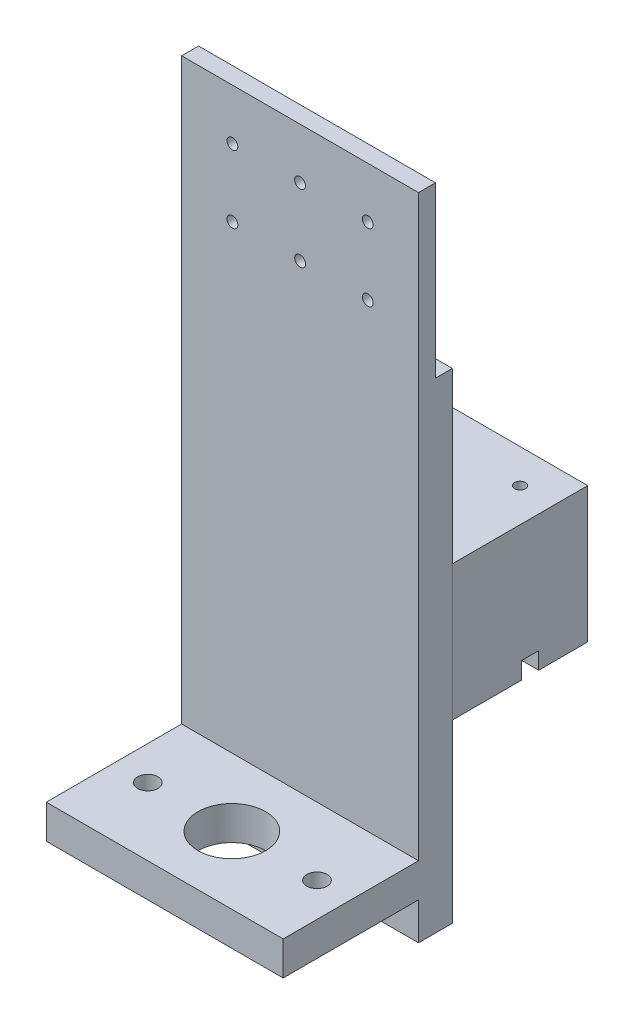
from build123d import *

# Parameters (mm, degrees)
SKETCH_1_W                     = 70
SKETCH_1_H                     = 40
EXTRUDE_1_DEPTH                = 40
SKETCH_2_R                     = 1.6
CUT_EXTRUDE_1_DEPTH            = 60.579081363
EXTRUDE_2_DEPTH                = 52
EXTRUDE_2_DEPTH_BACK           = 236
SKETCH_4_W                     = 70
SKETCH_4_H                     = 10
SKETCH_5_R                     = 2.5
CUT_EXTRUDE_2_DEPTH            = 10
SKETCH_6_R                     = 2.5
CUT_EXTRUDE_3_DEPTH            = 10
SKETCH_7_W                     = 70
SKETCH_7_H                     = 10
EXTRUDE_3_DEPTH                = 50
SKETCH_8_R                     = 12.5
CUT_EXTRUDE_4_DEPTH            = 10
SKETCH_12_W                    = 39
SKETCH_12_H                    = 39
SKETCH_12_W_2                  = 27
SKETCH_12_H_2                  = 27
EXTRUDE_2_2_DEPTH              = 15
SKETCH_14_R                    = 2
CUT_EXTRUDE_5_DEPTH            = 25
SKETCH_15_W                    = 70
SKETCH_15_H                    = 5
CUT_EXTRUDE_6_DEPTH            = 5
SKETCH_16_W                    = 70
SKETCH_16_H                    = 10
EXTRUDE_4_DEPTH                = 40
SKETCH_18_R                    = 3
CUT_EXTRUDE_7_DEPTH            = 313.929990298
SKETCH_19_R                    = 3
EXTRUDE_5_DEPTH                = 4
SKETCH_24_R                    = 10
CUT_EXTRUDE_9_DEPTH            = 10
SKETCH_26_R                    = 1.6
CUT_EXTRUDE_10_DEPTH           = 10
SPLIT_BODIES_1_SURFACE_1_BACK  = 334.12
SPLIT_BODIES_1_SURFACE_1_DEPTH = 668.24
SPLIT_BODIES_1_SURFACE_2_BACK  = 334.12
SPLIT_BODIES_1_SURFACE_2_DEPTH = 668.24


with BuildPart() as part:
    # 草图1 → 凸台-拉伸1 (new body)
    with BuildSketch(Plane(origin=(0, 0, 0), x_dir=(1, 0, 0), z_dir=(0, 1, 0))):
        with Locations((2.864103165, -2.71511892)):
            Rectangle(SKETCH_1_W, SKETCH_1_H)
    extrude(amount=EXTRUDE_1_DEPTH)

    # 草图2 → 切除-拉伸1 (cut, through all)
    with BuildSketch(Plane.XZ):
        with Locations(Location((-22.135896835, 17.71511892, 0), (0, 0, 270))):
            Circle(SKETCH_2_R)
        with Locations(Location((27.864103165, 17.71511892, 0), (0, 0, 90))):
            Circle(SKETCH_2_R)
        with Locations(Location((-22.135896835, -7.28488108, 0), (0, 0, 270))):
            Circle(SKETCH_2_R)
        with Locations(Location((27.864103165, -7.28488108, 0), (0, 0, 90))):
            Circle(SKETCH_2_R)
    extrude(amount=-CUT_EXTRUDE_1_DEPTH, mode=Mode.SUBTRACT)

    # 草图15 → 切除-拉伸6 (cut)
    with BuildSketch(Plane.XZ):
        with Locations((2.864103165, -0.28488108)):
            Rectangle(SKETCH_15_W, SKETCH_15_H)
    extrude(amount=-CUT_EXTRUDE_6_DEPTH, mode=Mode.SUBTRACT)


with BuildPart() as body_2:
    # 草图4 → Extrude 2 (new, two sides: drawn at the far end of the back side and taken through both)
    with BuildSketch(Plane.XZ.offset(-EXTRUDE_2_DEPTH_BACK)):
        with Locations((2.864103165, 27.71511892)):
            Rectangle(SKETCH_4_W, SKETCH_4_H)
    extrude(amount=EXTRUDE_2_DEPTH + EXTRUDE_2_DEPTH_BACK)

    # 草图5 → 切除-拉伸2 (cut)
    with BuildSketch(Plane.XY.offset(32.71511892)):
        with Locations((-18.135896835, -48)):
            Circle(SKETCH_5_R)
        with Locations(Location((23.864103165, -48, 0), (0, 0, 180))):
            Circle(SKETCH_5_R)
    extrude(amount=-CUT_EXTRUDE_2_DEPTH, mode=Mode.SUBTRACT)

    # 草图6 → 切除-拉伸3 (cut)
    with BuildSketch(Plane.XY.offset(32.71511892)):
        with Locations((-18.135896835, 212)):
            Circle(SKETCH_6_R)
        with Locations(Location((23.864103165, 212, 0), (0, 0, 180))):
            Circle(SKETCH_6_R)
    extrude(amount=-CUT_EXTRUDE_3_DEPTH, mode=Mode.SUBTRACT)

    # 草图7 → 凸台-拉伸3 (add)
    with BuildSketch(Plane(origin=(0, 0, 22.71511892), x_dir=(-1, 0, 0), z_dir=(0, 0, -1))):
        with Locations((-2.864103165, 241)):
            Rectangle(SKETCH_7_W, SKETCH_7_H)
    extrude(amount=-EXTRUDE_3_DEPTH)

    # 草图8 → 切除-拉伸4 (cut)
    with BuildSketch(Plane.XZ.offset(-236)):
        with Locations(Location((2.864103165, 52.71511892, 0), (0, 0, 270))):
            Circle(SKETCH_8_R)
    extrude(amount=-CUT_EXTRUDE_4_DEPTH, mode=Mode.SUBTRACT)

    # 草图12 → Extrude 2 2 (add)
    with BuildSketch(Plane(origin=(0, 246, 0), x_dir=(1, 0, 0), z_dir=(0, 1, 0))):
        with Locations((2.864103165, -52.71511892)):
            Rectangle(SKETCH_12_W, SKETCH_12_H)
        with Locations((2.864103165, -52.71511892)):
            Rectangle(SKETCH_12_W_2, SKETCH_12_H_2, mode=Mode.SUBTRACT)
    extrude(amount=EXTRUDE_2_2_DEPTH)

    # 草图14 → 切除-拉伸5 (cut)
    with BuildSketch(Plane(origin=(0, 261, 0), x_dir=(1, 0, 0), z_dir=(0, 1, 0))):
        with Locations(Location((-12.635896835, -37.21511892, 0), (0, 0, 270))):
            Circle(SKETCH_14_R)
        with Locations(Location((18.364103165, -37.21511892, 0), (0, 0, 90))):
            Circle(SKETCH_14_R)
        with Locations(Location((-12.635896835, -68.21511892, 0), (0, 0, 90))):
            Circle(SKETCH_14_R)
        with Locations(Location((18.364103165, -68.21511892, 0), (0, 0, 270))):
            Circle(SKETCH_14_R)
    extrude(amount=-CUT_EXTRUDE_5_DEPTH, mode=Mode.SUBTRACT)

    # 草图16 → 凸台-拉伸4 (add)
    with BuildSketch(Plane.XY.offset(32.71511892)):
        with Locations((2.864103165, -36)):
            Rectangle(SKETCH_16_W, SKETCH_16_H)
    extrude(amount=EXTRUDE_4_DEPTH)

    # 草图18 → 切除-拉伸7 (cut, through all)
    with BuildSketch(Plane.XZ.offset(41)):
        with Locations(Location((-22.135896835, 52.71511892, 0), (0, 0, 270))):
            Circle(SKETCH_18_R)
        with Locations(Location((27.864103165, 52.71511892, 0), (0, 0, 270))):
            Circle(SKETCH_18_R)
    extrude(amount=-CUT_EXTRUDE_7_DEPTH, mode=Mode.SUBTRACT)

    # 草图19 → 凸台-拉伸5 (add)
    with BuildSketch(Plane.XZ.offset(41)):
        with Locations(Location((-22.135896835, 52.71511892, 0), (0, 0, 270))):
            Circle(SKETCH_19_R)
        with Locations(Location((27.864103165, 52.71511892, 0), (0, 0, 270))):
            Circle(SKETCH_19_R)
    extrude(amount=-EXTRUDE_5_DEPTH)

    # 草图24 → 切除-拉伸9 (cut)
    with BuildSketch(Plane.XZ.offset(41)):
        with Locations(Location((2.704454521, 52.71511892, 0), (0, 0, 270))):
            Circle(SKETCH_24_R)
    extrude(amount=-CUT_EXTRUDE_9_DEPTH, mode=Mode.SUBTRACT)

    # 草图26 → 切除-拉伸10 (cut)
    with BuildSketch(Plane(origin=(0, 0, 22.71511892), x_dir=(-1, 0, 0), z_dir=(0, 0, -1))):
        with Locations((17.135896835, 105)):
            Circle(SKETCH_26_R)
        with Locations((-2.864103165, 105)):
            Circle(SKETCH_26_R)
        with Locations((-22.864103165, 105)):
            Circle(SKETCH_26_R)
        with Locations(Location((17.135896835, 125, 0), (0, 0, 180))):
            Circle(SKETCH_26_R)
        with Locations(Location((-2.864103165, 125, 0), (0, 0, 180))):
            Circle(SKETCH_26_R)
        with Locations(Location((-22.864103165, 125, 0), (0, 0, 180))):
            Circle(SKETCH_26_R)
    extrude(amount=-CUT_EXTRUDE_10_DEPTH, mode=Mode.SUBTRACT)


with BuildPart() as body_3:
    # Split Bodies 1: the piece behind the surface
    add(body_2.part)
    # Split Bodies 1 surface: a surface, the sketch's curves swept straight by 668.24 mm
    with BuildLine(Plane.ZY.offset(32.135896835).offset(-SPLIT_BODIES_1_SURFACE_1_BACK), mode=Mode.PRIVATE) as split_bodies_1_surface_1_path:
        Line((22.71511892, 90), (27.71511892, 90))
        Line((27.71511892, 90), (27.71511892, 140))
        Line((27.71511892, 140), (32.71511892, 140))
    split_bodies_1_surface_1 = Shell.extrude(split_bodies_1_surface_1_path.wire(), (-1 * SPLIT_BODIES_1_SURFACE_1_DEPTH, 0 * SPLIT_BODIES_1_SURFACE_1_DEPTH, 0 * SPLIT_BODIES_1_SURFACE_1_DEPTH))
    split(bisect_by=split_bodies_1_surface_1, keep=Keep.BOTTOM)


with BuildPart() as body_2_1:
    add(body_2.part)

    # Split Bodies 1: split by a surface, the side it looks to stays
    # Split Bodies 1 surface: a surface, the sketch's curves swept straight by 668.24 mm
    with BuildLine(Plane.ZY.offset(32.135896835).offset(-SPLIT_BODIES_1_SURFACE_2_BACK), mode=Mode.PRIVATE) as split_bodies_1_surface_2_path:
        Line((22.71511892, 90), (27.71511892, 90))
        Line((27.71511892, 90), (27.71511892, 140))
        Line((27.71511892, 140), (32.71511892, 140))
    split_bodies_1_surface_2 = Shell.extrude(split_bodies_1_surface_2_path.wire(), (-1 * SPLIT_BODIES_1_SURFACE_2_DEPTH, 0 * SPLIT_BODIES_1_SURFACE_2_DEPTH, 0 * SPLIT_BODIES_1_SURFACE_2_DEPTH))
    split(bisect_by=split_bodies_1_surface_2, keep=Keep.TOP)


solid = Compound([part.part, body_3.part])
